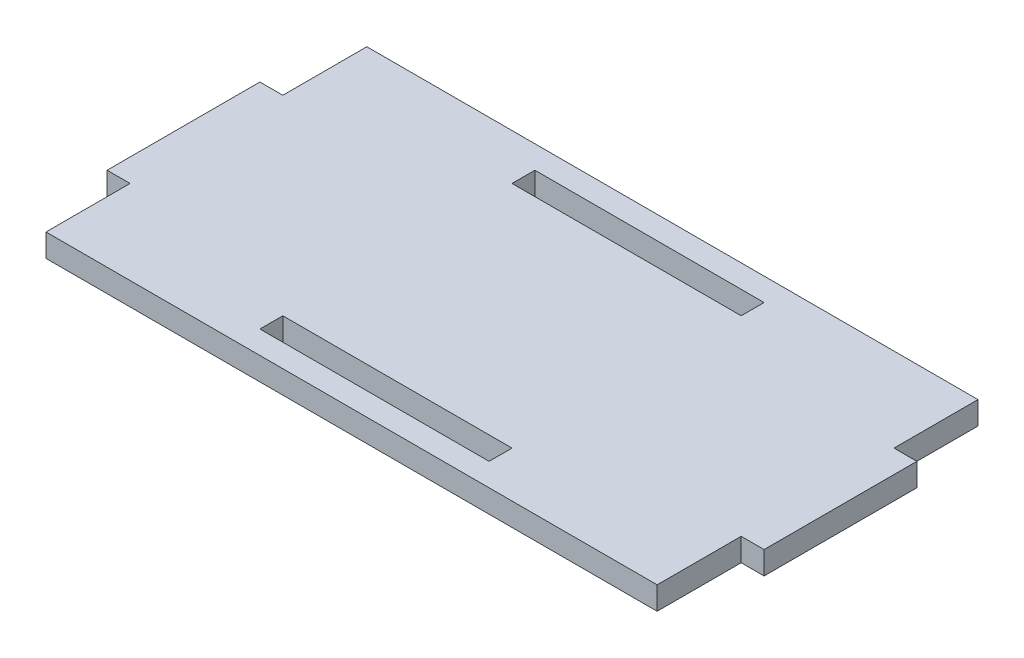
from build123d import *

# Parameters (mm, degrees)
SKETCH1_W           = 30
SKETCH1_H           = 3
BOSS_EXTRUDE1_DEPTH = 3


with BuildPart() as part:
    # Sketch1 → Boss-Extrude1 (new body)
    with BuildSketch(Plane(origin=(0, 0, 0), x_dir=(1, 0, 0), z_dir=(0, 1, 0))):
        Polygon((0, 31), (0, 42), (80, 42), (80, 31), (83, 31), (83, 11), (80, 11), (80, 0), (0, 0), (0, 11), (-3, 11), (-3, 31), align=None)
        with Locations((40, 37.5)):
            Rectangle(SKETCH1_W, SKETCH1_H, mode=Mode.SUBTRACT)
        with Locations((40, 4.5)):
            Rectangle(SKETCH1_W, SKETCH1_H, mode=Mode.SUBTRACT)
    extrude(amount=BOSS_EXTRUDE1_DEPTH)


solid = part.part
